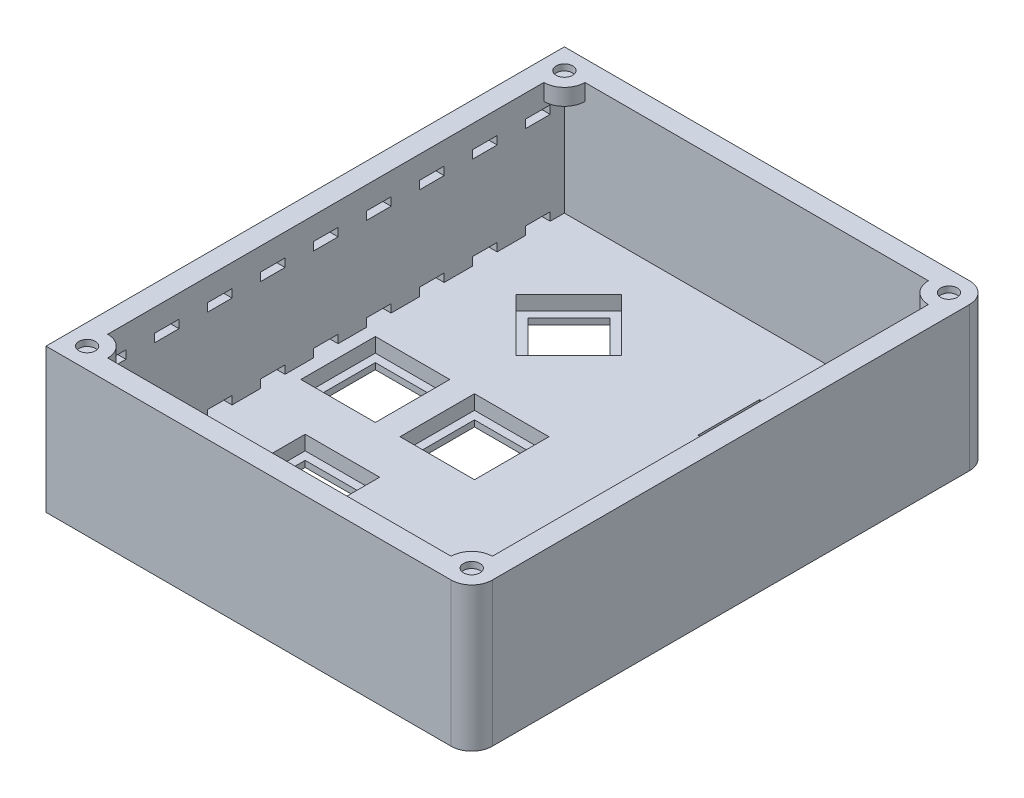
from build123d import *

# Parameters (mm, degrees)
SKETCH1_W               = 14.1
SKETCH1_H               = 14.1
BOSS_EXTRUDE1_DEPTH     = 5
BOSS_EXTRUDE2_START     = 30
SKETCH1_3_W             = 186.968838354
SKETCH1_3_H             = 116
BOSS_EXTRUDE2_DEPTH     = 30
SKETCH3_W               = 18.1
SKETCH3_H               = 18.1
CUT_EXTRUDE1_DEPTH      = 3.5
CUT_EXTRUDE2_DEPTH      = 230.604082932
CUT_EXTRUDE2_DEPTH_BACK = 230.604082932
SKETCH4_W               = 139.180586207
SKETCH4_H               = 157.726958194
CUT_EXTRUDE3_DEPTH      = 229.895248747
CUT_EXTRUDE3_DEPTH_BACK = 3
SKETCH5_W               = 15
SKETCH5_H               = 15
SKETCH6_W               = 5
SKETCH6_H               = 126
BOSS_EXTRUDE3_DEPTH     = 35
BOSS_EXTRUDE4_DEPTH     = 4
CUT_EXTRUDE4_DEPTH      = 1.5
SKETCH8_R               = 2
CUT_EXTRUDE5_DEPTH      = 1.5
LPATTERN1_COUNT         = 10
LPATTERN1_PITCH         = 12.888888889
LPATTERN1_COUNT_DIR2    = 2
LPATTERN1_PITCH_DIR2    = 25
SKETCH9_W               = 6
SKETCH9_H               = 2
CUT_EXTRUDE6_DEPTH      = 5
LPATTERN2_COUNT         = 9
LPATTERN2_PITCH         = 12.888888889
LPATTERN2_COUNT_DIR2    = 2
LPATTERN2_PITCH_DIR2    = 22.5


with BuildPart() as part:
    # Sketch1 → Boss-Extrude1 (new body)
    with BuildSketch(Plane(origin=(0, 0, 0), x_dir=(1, 0, 0), z_dir=(0, 1, 0))):
        with BuildLine():
            Line((-5, 116), (-5, 0))
            ThreePointArc((-5, 0), (-3.535533906, -3.535533906), (0, -5))
            Line((0, -5), (186.968838354, -5))
            ThreePointArc((186.968838354, -5), (190.50437226, -3.535533906), (191.968838354, 0))
            Line((191.968838354, 0), (191.968838354, 116))
            ThreePointArc((191.968838354, 116), (190.50437226, 119.535533906), (186.968838354, 121))
            Line((186.968838354, 121), (0, 121))
            ThreePointArc((0, 121), (-3.535533906, 119.535533906), (-5, 116))
        make_face()
        with Locations((57.334419177, 58)):
            Rectangle(SKETCH1_W, SKETCH1_H, mode=Mode.SUBTRACT)
        with Locations((81.434419177, 58)):
            Rectangle(SKETCH1_W, SKETCH1_H, mode=Mode.SUBTRACT)
        with Locations((69.384419177, 28.9)):
            Rectangle(SKETCH1_W, SKETCH1_H, mode=Mode.SUBTRACT)
        with Locations((117.584419177, 28.9)):
            Rectangle(SKETCH1_W, SKETCH1_H, mode=Mode.SUBTRACT)
        with Locations((105.534419177, 58)):
            Rectangle(SKETCH1_W, SKETCH1_H, mode=Mode.SUBTRACT)
        with Locations((129.634419177, 58)):
            Rectangle(SKETCH1_W, SKETCH1_H, mode=Mode.SUBTRACT)
        Polygon((79.354624792, 93), (69.384419177, 83.029794385), (59.414213562, 93), (69.384419177, 102.970205615), align=None, mode=Mode.SUBTRACT)
        Polygon((107.614213562, 93), (117.584419177, 102.970205615), (127.554624792, 93), (117.584419177, 83.029794385), align=None, mode=Mode.SUBTRACT)
        with BuildLine():
            Line((17.6, 94.25), (19.016518483, 94.25))
            ThreePointArc((19.016518483, 94.25), (23, 97.175), (26.983481517, 94.25))
            Line((26.983481517, 94.25), (28.4, 94.25))
            Line((28.4, 94.25), (28.4, 91.75))
            Line((28.4, 91.75), (26.983481517, 91.75))
            ThreePointArc((26.983481517, 91.75), (23, 88.825), (19.016518483, 91.75))
            Line((19.016518483, 91.75), (17.6, 91.75))
            Line((17.6, 91.75), (17.6, 94.25))
        make_face(mode=Mode.SUBTRACT)
        with BuildLine():
            Line((169.368838354, 91.75), (167.952319872, 91.75))
            ThreePointArc((167.952319872, 91.75), (163.968838354, 88.825), (159.985356837, 91.75))
            Line((159.985356837, 91.75), (158.568838354, 91.75))
            Line((158.568838354, 91.75), (158.568838354, 94.25))
            Line((158.568838354, 94.25), (159.985356837, 94.25))
            ThreePointArc((159.985356837, 94.25), (163.968838354, 97.175), (167.952319872, 94.25))
            Line((167.952319872, 94.25), (169.368838354, 94.25))
            Line((169.368838354, 94.25), (169.368838354, 91.75))
        make_face(mode=Mode.SUBTRACT)
    extrude(amount=-BOSS_EXTRUDE1_DEPTH)

    # Sketch1<3> → Boss-Extrude2 (add)
    with BuildSketch(Plane(origin=(0, 0, 0), x_dir=(1, 0, 0), z_dir=(0, 1, 0)).offset(BOSS_EXTRUDE2_START)):
        with BuildLine():
            Line((-5, 116), (-5, 0))
            ThreePointArc((-5, 0), (-3.535533906, -3.535533906), (0, -5))
            Line((0, -5), (186.968838354, -5))
            ThreePointArc((186.968838354, -5), (190.50437226, -3.535533906), (191.968838354, 0))
            Line((191.968838354, 0), (191.968838354, 116))
            ThreePointArc((191.968838354, 116), (190.50437226, 119.535533906), (186.968838354, 121))
            Line((186.968838354, 121), (0, 121))
            ThreePointArc((0, 121), (-3.535533906, 119.535533906), (-5, 116))
        make_face()
        with Locations((93.484419177, 58)):
            Rectangle(SKETCH1_3_W, SKETCH1_3_H, mode=Mode.SUBTRACT)
    extrude(amount=-BOSS_EXTRUDE2_DEPTH)

    # Sketch3 → Cut-Extrude1 (cut)
    with BuildSketch(Plane(origin=(0, 0, 0), x_dir=(1, 0, 0), z_dir=(0, 1, 0))):
        with Locations((57.334419177, 58)):
            Rectangle(SKETCH3_W, SKETCH3_H)
        Polygon((69.384419177, 105.798632739), (56.585786438, 93), (69.384419177, 80.201367261), (82.183051917, 93), align=None)
        with Locations((69.384419177, 28.9)):
            Rectangle(SKETCH3_W, SKETCH3_H)
        with Locations((81.434419177, 58)):
            Rectangle(SKETCH3_W, SKETCH3_H)
        with Locations((105.534419177, 58)):
            Rectangle(SKETCH3_W, SKETCH3_H)
        with Locations((129.634419177, 58)):
            Rectangle(SKETCH3_W, SKETCH3_H)
        Polygon((104.785786438, 93), (117.584419177, 80.201367261), (130.383051917, 93), (117.584419177, 105.798632739), align=None)
        with Locations((117.584419177, 28.9)):
            Rectangle(SKETCH3_W, SKETCH3_H)
    extrude(amount=-CUT_EXTRUDE1_DEPTH, mode=Mode.SUBTRACT)

    # Sketch4 → Cut-Extrude2 (cut, two sides: drawn at the far end of the back side and taken through both)
    with BuildSketch(Plane.XZ.offset(5).offset(-CUT_EXTRUDE2_DEPTH_BACK)):
        with Locations((23.894126074, -46.845057358)):
            Rectangle(SKETCH4_W, SKETCH4_H)
    extrude(amount=CUT_EXTRUDE2_DEPTH + CUT_EXTRUDE2_DEPTH_BACK, mode=Mode.SUBTRACT)

    # Sketch5 → Cut-Extrude3 (cut, two sides: drawn at the far end of the back side and taken through both)
    with BuildSketch(Plane(origin=(0, 0, 0), x_dir=(1, 0, 0), z_dir=(0, 1, 0)).offset(-CUT_EXTRUDE3_DEPTH_BACK)):
        with Locations((163.968838354, 93)):
            Rectangle(SKETCH5_W, SKETCH5_H)
    extrude(amount=CUT_EXTRUDE3_DEPTH + CUT_EXTRUDE3_DEPTH_BACK, mode=Mode.SUBTRACT)

    # Sketch6 → Boss-Extrude3 (add)
    with BuildSketch(Plane.XZ.offset(5)):
        with Locations((90.984419177, -58)):
            Rectangle(SKETCH6_W, SKETCH6_H)
    extrude(amount=-BOSS_EXTRUDE3_DEPTH)

    # Sketch7 → Boss-Extrude4 (add)
    with BuildSketch(Plane(origin=(0, 30, 0), x_dir=(1, 0, 0), z_dir=(0, 1, 0))):
        with BuildLine():
            Line((95.484419177, 116), (98.484419177, 116))
            ThreePointArc((98.484419177, 116), (89.948885271, 119.535533906), (93.484419177, 111))
            Line((93.484419177, 111), (93.484419177, 114))
            ThreePointArc((93.484419177, 114), (92.070205615, 117.414213562), (95.484419177, 116))
        make_face()
        with BuildLine():
            ThreePointArc((93.484419177, 111), (97.019953083, 112.464466094), (98.484419177, 116))
            Line((98.484419177, 116), (95.484419177, 116))
            ThreePointArc((95.484419177, 116), (94.898632739, 114.585786438), (93.484419177, 114))
            Line((93.484419177, 114), (93.484419177, 111))
        make_face()
        with BuildLine():
            Line((93.484419177, 116), (95.484419177, 116))
            ThreePointArc((95.484419177, 116), (92.070205615, 117.414213562), (93.484419177, 114))
            Line((93.484419177, 114), (93.484419177, 116))
        make_face()
        with BuildLine():
            ThreePointArc((93.484419177, 114), (94.898632739, 114.585786438), (95.484419177, 116))
            Line((95.484419177, 116), (93.484419177, 116))
            Line((93.484419177, 116), (93.484419177, 114))
        make_face()
        with BuildLine():
            Line((184.968838354, 116), (181.968838354, 116))
            ThreePointArc((181.968838354, 116), (183.433304448, 112.464466094), (186.968838354, 111))
            Line((186.968838354, 111), (186.968838354, 114))
            ThreePointArc((186.968838354, 114), (185.554624792, 114.585786438), (184.968838354, 116))
        make_face()
        with BuildLine():
            ThreePointArc((186.968838354, 121), (183.433304448, 119.535533906), (181.968838354, 116))
            Line((181.968838354, 116), (184.968838354, 116))
            ThreePointArc((184.968838354, 116), (186.968838354, 118), (188.968838354, 116))
            ThreePointArc((188.968838354, 116), (188.383051917, 114.585786438), (186.968838354, 114))
            Line((186.968838354, 114), (186.968838354, 111))
            ThreePointArc((186.968838354, 111), (190.50437226, 112.464466094), (191.968838354, 116))
            ThreePointArc((191.968838354, 116), (190.50437226, 119.535533906), (186.968838354, 121))
        make_face()
        with BuildLine():
            Line((186.968838354, 116), (184.968838354, 116))
            ThreePointArc((184.968838354, 116), (185.554624792, 114.585786438), (186.968838354, 114))
            Line((186.968838354, 114), (186.968838354, 116))
        make_face()
        with BuildLine():
            ThreePointArc((188.968838354, 116), (186.968838354, 118), (184.968838354, 116))
            Line((184.968838354, 116), (186.968838354, 116))
            Line((186.968838354, 116), (186.968838354, 114))
            ThreePointArc((186.968838354, 114), (188.383051917, 114.585786438), (188.968838354, 116))
        make_face()
        with BuildLine():
            ThreePointArc((191.968838354, 0), (190.50437226, 3.535533906), (186.968838354, 5))
            Line((186.968838354, 5), (186.968838354, 2))
            ThreePointArc((186.968838354, 2), (188.383051917, 1.414213562), (188.968838354, 0))
            ThreePointArc((188.968838354, 0), (186.968838354, -2), (184.968838354, 0))
            Line((184.968838354, 0), (181.968838354, 0))
            ThreePointArc((181.968838354, 0), (183.433304448, -3.535533906), (186.968838354, -5))
            ThreePointArc((186.968838354, -5), (190.50437226, -3.535533906), (191.968838354, 0))
        make_face()
        with BuildLine():
            Line((186.968838354, 0), (186.968838354, 2))
            ThreePointArc((186.968838354, 2), (185.554624792, 1.414213562), (184.968838354, 0))
            Line((184.968838354, 0), (186.968838354, 0))
        make_face()
        with BuildLine():
            ThreePointArc((188.968838354, 0), (188.383051917, 1.414213562), (186.968838354, 2))
            Line((186.968838354, 2), (186.968838354, 0))
            Line((186.968838354, 0), (184.968838354, 0))
            ThreePointArc((184.968838354, 0), (186.968838354, -2), (188.968838354, 0))
        make_face()
        with BuildLine():
            Line((186.968838354, 2), (186.968838354, 5))
            ThreePointArc((186.968838354, 5), (183.433304448, 3.535533906), (181.968838354, 0))
            Line((181.968838354, 0), (184.968838354, 0))
            ThreePointArc((184.968838354, 0), (185.554624792, 1.414213562), (186.968838354, 2))
        make_face()
        with BuildLine():
            Line((93.484419177, 2), (93.484419177, 5))
            ThreePointArc((93.484419177, 5), (89.948885271, -3.535533906), (98.484419177, 0))
            Line((98.484419177, 0), (95.484419177, 0))
            ThreePointArc((95.484419177, 0), (92.070205615, -1.414213562), (93.484419177, 2))
        make_face()
        with BuildLine():
            ThreePointArc((98.484419177, 0), (97.019953083, 3.535533906), (93.484419177, 5))
            Line((93.484419177, 5), (93.484419177, 2))
            ThreePointArc((93.484419177, 2), (94.898632739, 1.414213562), (95.484419177, 0))
            Line((95.484419177, 0), (98.484419177, 0))
        make_face()
        with BuildLine():
            Line((93.484419177, 0), (93.484419177, 2))
            ThreePointArc((93.484419177, 2), (92.070205615, -1.414213562), (95.484419177, 0))
            Line((95.484419177, 0), (93.484419177, 0))
        make_face()
        with BuildLine():
            ThreePointArc((95.484419177, 0), (94.898632739, 1.414213562), (93.484419177, 2))
            Line((93.484419177, 2), (93.484419177, 0))
            Line((93.484419177, 0), (95.484419177, 0))
        make_face()
    extrude(amount=-BOSS_EXTRUDE4_DEPTH)

    # Sketch7<3> → Cut-Extrude4 (cut)
    with BuildSketch(Plane(origin=(0, 30, 0), x_dir=(1, 0, 0), z_dir=(0, 1, 0))):
        with BuildLine():
            Line((93.484419177, 116), (95.484419177, 116))
            ThreePointArc((95.484419177, 116), (92.070205615, 117.414213562), (93.484419177, 114))
            Line((93.484419177, 114), (93.484419177, 116))
        make_face()
        with BuildLine():
            ThreePointArc((93.484419177, 114), (94.898632739, 114.585786438), (95.484419177, 116))
            Line((95.484419177, 116), (93.484419177, 116))
            Line((93.484419177, 116), (93.484419177, 114))
        make_face()
        with BuildLine():
            Line((186.968838354, 116), (184.968838354, 116))
            ThreePointArc((184.968838354, 116), (185.554624792, 114.585786438), (186.968838354, 114))
            Line((186.968838354, 114), (186.968838354, 116))
        make_face()
        with BuildLine():
            ThreePointArc((188.968838354, 116), (186.968838354, 118), (184.968838354, 116))
            Line((184.968838354, 116), (186.968838354, 116))
            Line((186.968838354, 116), (186.968838354, 114))
            ThreePointArc((186.968838354, 114), (188.383051917, 114.585786438), (188.968838354, 116))
        make_face()
        with BuildLine():
            Line((186.968838354, 0), (186.968838354, 2))
            ThreePointArc((186.968838354, 2), (185.554624792, 1.414213562), (184.968838354, 0))
            Line((184.968838354, 0), (186.968838354, 0))
        make_face()
        with BuildLine():
            ThreePointArc((188.968838354, 0), (188.383051917, 1.414213562), (186.968838354, 2))
            Line((186.968838354, 2), (186.968838354, 0))
            Line((186.968838354, 0), (184.968838354, 0))
            ThreePointArc((184.968838354, 0), (186.968838354, -2), (188.968838354, 0))
        make_face()
        with BuildLine():
            Line((93.484419177, 0), (93.484419177, 2))
            ThreePointArc((93.484419177, 2), (92.070205615, -1.414213562), (95.484419177, 0))
            Line((95.484419177, 0), (93.484419177, 0))
        make_face()
        with BuildLine():
            ThreePointArc((95.484419177, 0), (94.898632739, 1.414213562), (93.484419177, 2))
            Line((93.484419177, 2), (93.484419177, 0))
            Line((93.484419177, 0), (95.484419177, 0))
        make_face()
    extrude(amount=-CUT_EXTRUDE4_DEPTH, mode=Mode.SUBTRACT)

    # Sketch8 → Cut-Extrude5 (cut)
    with BuildSketch(Plane.ZY.offset(-88.484419177)):
        Circle(SKETCH8_R)
    cut_extrude5 = extrude(amount=-CUT_EXTRUDE5_DEPTH, mode=Mode.SUBTRACT)

    # LPattern1: Cut-Extrude5 10 × 2
    with Locations(*[(0, j * LPATTERN1_PITCH_DIR2, -i * LPATTERN1_PITCH) for i in range(LPATTERN1_COUNT) for j in range(LPATTERN1_COUNT_DIR2) if (i, j) != (0, 0)]):
        add(cut_extrude5, mode=Mode.SUBTRACT)

    # Sketch9 → Cut-Extrude6 (cut)
    with BuildSketch(Plane.ZY.offset(-88.484419177)):
        with Locations((-6.444444444, 1)):
            Rectangle(SKETCH9_W, SKETCH9_H)
    cut_extrude6 = extrude(amount=-CUT_EXTRUDE6_DEPTH, mode=Mode.SUBTRACT)

    # LPattern2: Cut-Extrude6 9 × 2
    with Locations(*[(0, j * LPATTERN2_PITCH_DIR2, -i * LPATTERN2_PITCH) for i in range(LPATTERN2_COUNT) for j in range(LPATTERN2_COUNT_DIR2) if (i, j) != (0, 0)]):
        add(cut_extrude6, mode=Mode.SUBTRACT)


solid = part.part
